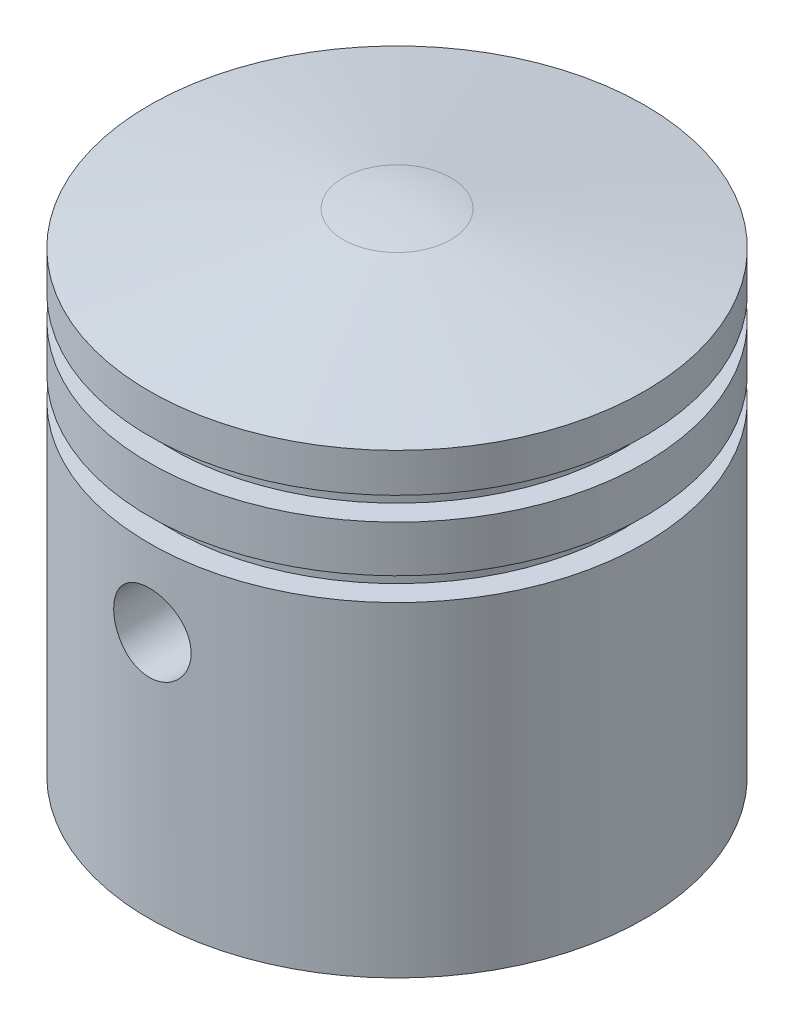
from build123d import *

# Parameters (mm, degrees)
CUT_EXTRUDE1_DEPTH      = 39
CUT_EXTRUDE1_DEPTH_BACK = 50
SKETCH2_R               = 2.5


with BuildPart() as part:
    # Sketch1 → Revolve2 (revolve)
    with BuildSketch(Plane.XY, mode=Mode.PRIVATE) as revolve2_sk:
        with BuildLine():
            Line((13, 0), (13, 10))
            Line((13, 10), (10, 10))
            Line((10, 10), (10, 24))
            Line((10, 24), (0, 24))
            Line((0, 24), (0, 32))
            Line((0, 32), (0, 32.027132664))
            ThreePointArc((0, 32.027132664), (1.743114855, 31.951026626), (3.472963553, 31.723287724))
            Line((3.472963553, 31.723287724), (16, 29.51443321))
            Line((16, 29.51443321), (16, 27))
            Line((16, 27), (14.5, 27))
            Line((14.5, 27), (14.5, 25.5))
            Line((14.5, 25.5), (16, 25.5))
            Line((16, 25.5), (16, 22.5))
            Line((16, 22.5), (14.5, 22.5))
            Line((14.5, 22.5), (14.5, 21))
            Line((14.5, 21), (16, 21))
            Line((16, 21), (16, 0))
            Line((16, 0), (13, 0))
        make_face()
    revolve(revolve2_sk.sketch.rotate(Axis((0, 0, 0), (0, 1, 0)), 90), axis=Axis((0, 0, 0), (0, 1, 0)))

    # Sketch2 → Cut-Extrude1 (cut, two sides: drawn at the far end of the back side and taken through both)
    with BuildSketch(Plane.XY.offset(-CUT_EXTRUDE1_DEPTH_BACK)):
        with Locations(Location((0, 16, 0), (0, 0, 180))):
            Circle(SKETCH2_R)
    extrude(amount=CUT_EXTRUDE1_DEPTH + CUT_EXTRUDE1_DEPTH_BACK, mode=Mode.SUBTRACT)


solid = part.part
